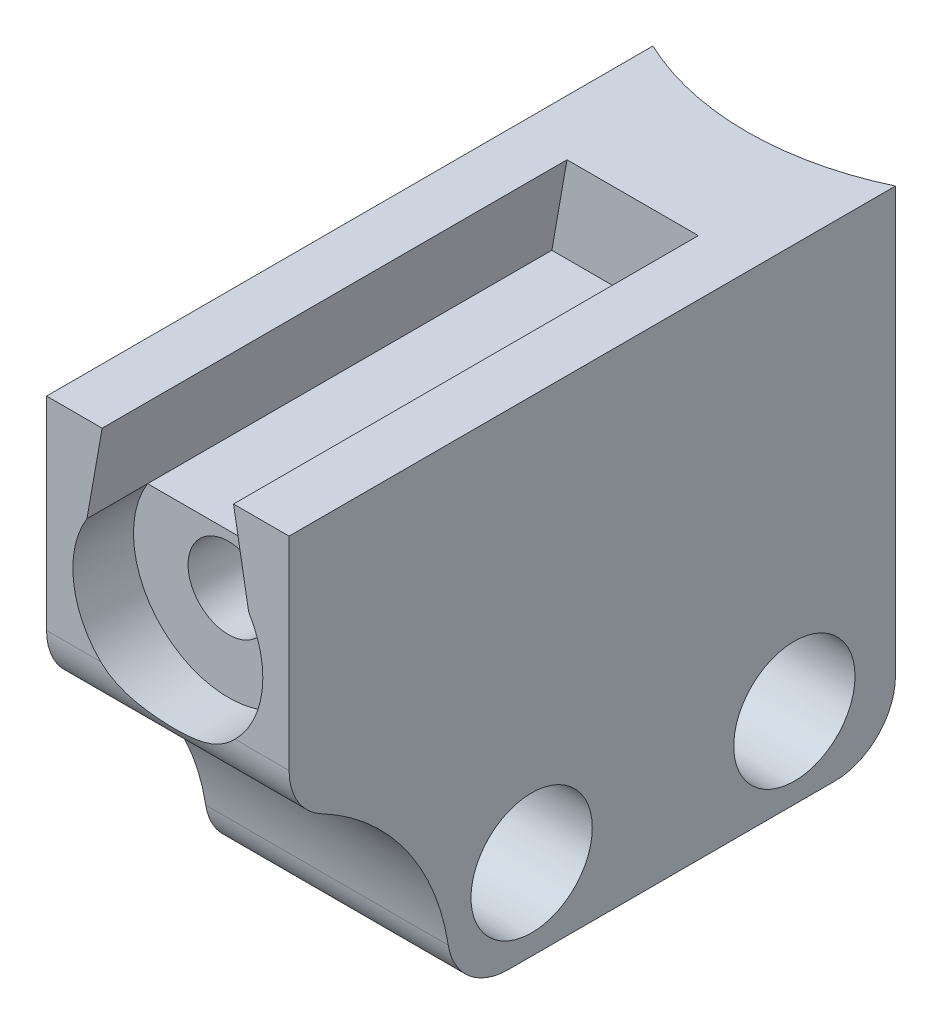
from build123d import *

# Parameters (mm, degrees)
SKETCH1_R           = 3
BOSS_EXTRUDE1_DEPTH = 6
FILLET1_R           = 3
SKETCH2_R           = 2
CUT_EXTRUDE1_DEPTH  = 33.86335345
CUT_EXTRUDE2_DEPTH  = 23
SKETCH2_4_R         = 2
CUT_EXTRUDE3_DEPTH  = 3
CUT_EXTRUDE4_DEPTH  = 29.930952356


with BuildPart() as part:
    # Sketch1 → Boss-Extrude1 (new, symmetric)
    with BuildSketch(Plane(origin=(0, 0, 0), x_dir=(0, 0, -1), z_dir=(1, 0, 0))):
        with BuildLine():
            Line((-15, 12), (15, 12))
            Line((15, 12), (15, -12))
            Line((15, -12), (-7, -12))
            ThreePointArc((-7, -12), (-8.996142529, -4.664095019), (-15, 0))
            Line((-15, 0), (-15, 12))
        make_face()
        with Locations((-3, -8)):
            Circle(SKETCH1_R, mode=Mode.SUBTRACT)
        with Locations((10, -8)):
            Circle(SKETCH1_R, mode=Mode.SUBTRACT)
    extrude(amount=BOSS_EXTRUDE1_DEPTH, both=True)

    # Fillet1
    fillet1_edges = [part.edges().sort_by_distance(p)[0] for p in [
        (0, -12, -15),
        (0, -12, 7),
        (0, 0, 15),
    ]]
    fillet(fillet1_edges, radius=FILLET1_R)

    # Sketch2 → Cut-Extrude1 (cut, through all)
    with BuildSketch(Plane.XY.offset(15)):
        with Locations((0, 5.278746099)):
            Circle(SKETCH2_R)
    extrude(amount=-CUT_EXTRUDE1_DEPTH, mode=Mode.SUBTRACT)

    # Sketch2<3> → Cut-Extrude2 (cut)
    with BuildSketch(Plane.XY.offset(15)):
        Polygon((3.25, 12), (-3.25, 12), (-4, 7.746538635), (4, 7.746538635), align=None)
    extrude(amount=-CUT_EXTRUDE2_DEPTH, mode=Mode.SUBTRACT)

    # Sketch2<4> → Cut-Extrude3 (cut)
    with BuildSketch(Plane.XY.offset(15)):
        with BuildLine():
            Line((4, 7.746538635), (-4, 7.746538635))
            ThreePointArc((-4, 7.746538635), (0, 0.578746099), (4, 7.746538635))
        make_face()
        with Locations((0, 5.278746099)):
            Circle(SKETCH2_4_R, mode=Mode.SUBTRACT)
    extrude(amount=-CUT_EXTRUDE3_DEPTH, mode=Mode.SUBTRACT)

    # Sketch3 → Cut-Extrude4 (cut, through all)
    with BuildSketch(Plane(origin=(0, 12, 0), x_dir=(1, 0, 0), z_dir=(0, 1, 0))):
        with BuildLine():
            Line((6, 15), (-6, 15))
            ThreePointArc((-6, 15), (0, 13.649110641), (6, 15))
        make_face()
    extrude(amount=-CUT_EXTRUDE4_DEPTH, mode=Mode.SUBTRACT)


solid = part.part
